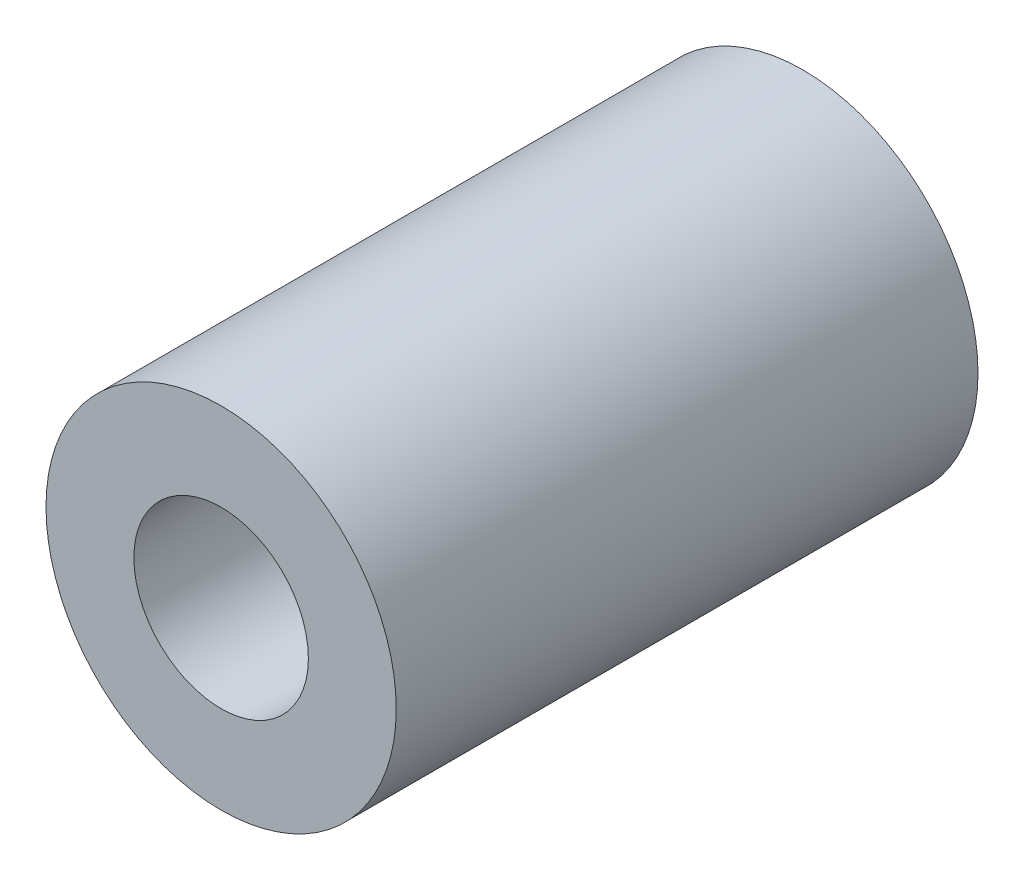
from build123d import *

# Parameters (mm, degrees)
SKETCH1_R      = 3.01
SKETCH1_R_2    = 1.5
EXTRUDE1_DEPTH = 5


with BuildPart() as part:
    # Sketch1 → Extrude1 (new, symmetric)
    with BuildSketch(Plane.XY):
        Circle(SKETCH1_R)
        Circle(SKETCH1_R_2, mode=Mode.SUBTRACT)
    extrude(amount=EXTRUDE1_DEPTH, both=True)


solid = part.part
